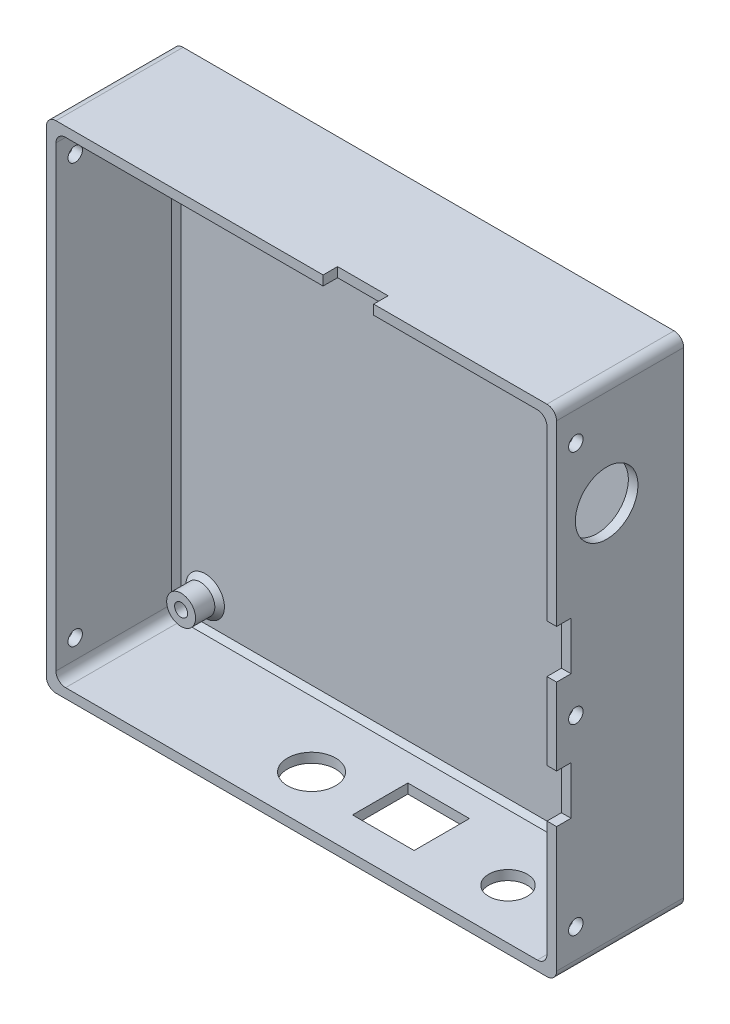
from build123d import *

# Parameters (mm, degrees)
SKETCH_1_W          = 106
SKETCH_1_H          = 103
SKETCH_1_W_2        = 102
SKETCH_1_H_2        = 99
EXTRUDE_1_DEPTH     = 25
SKETCH_2_W          = 106
SKETCH_2_H          = 103
EXTRUDE_2_DEPTH     = 1.4
SKETCH_3_R          = 3
SKETCH_3_R_2        = 1.35
EXTRUDE_3_DEPTH     = 5
SKETCH_4_W          = 12.8
SKETCH_4_H          = 11.5
CUT_EXTRUDE_1_DEPTH = 101
FILLET_1_R          = 2
CHAMFER_1_SIZE      = 1
SKETCH_5_R          = 4
SKETCH_5_R_2        = 5
CUT_EXTRUDE_2_DEPTH = 2
SKETCH_6_W          = 3
SKETCH_6_H          = 10
CUT_EXTRUDE_3_DEPTH = 2
SKETCH_8_R          = 1.5
CUT_EXTRUDE_4_DEPTH = 121.470950855
SKETCH_9_R          = 1.5
CUT_EXTRUDE_5_DEPTH = 2
SKETCH_10_W         = 10.5
SKETCH_10_H         = 3
CUT_EXTRUDE_6_DEPTH = 2
SKETCH_11_R         = 6.5
CUT_EXTRUDE_7_DEPTH = 2


with BuildPart() as part:
    # Эскиз1 → Бобышка-Вытянуть1 (new body)
    with BuildSketch(Plane.XY):
        Rectangle(SKETCH_1_W, SKETCH_1_H)
        Rectangle(SKETCH_1_W_2, SKETCH_1_H_2, mode=Mode.SUBTRACT)
    extrude(amount=EXTRUDE_1_DEPTH)

    # Эскиз2 → Бобышка-Вытянуть2 (add)
    with BuildSketch(Plane(origin=(0, 0, 0), x_dir=(-1, 0, 0), z_dir=(0, 0, -1))):
        Rectangle(SKETCH_2_W, SKETCH_2_H)
    extrude(amount=EXTRUDE_2_DEPTH)

    # Эскиз3 → Бобышка-Вытянуть3 (add)
    # profile 1 of 4: a face of its own
    with BuildSketch(Plane.XY):
        with Locations(Location((-45, 39.5, 0), (0, 0, 180))):
            Circle(SKETCH_3_R)
        with Locations((-45, 39.5)):
            Circle(SKETCH_3_R_2, mode=Mode.SUBTRACT)
    # profile 2 of 4: a face of its own
    with BuildSketch(Plane.XY):
        with Locations(Location((45, 39.5, 0), (0, 0, 180))):
            Circle(SKETCH_3_R)
        with Locations((45, 39.5)):
            Circle(SKETCH_3_R_2, mode=Mode.SUBTRACT)
    # profile 3 of 4: a face of its own
    with BuildSketch(Plane.XY):
        with Locations(Location((-45, -43.5, 0), (0, 0, 180))):
            Circle(SKETCH_3_R)
        with Locations((-45, -43.5)):
            Circle(SKETCH_3_R_2, mode=Mode.SUBTRACT)
    # profile 4 of 4: a face of its own
    with BuildSketch(Plane.XY):
        with Locations(Location((45, -43.5, 0), (0, 0, 180))):
            Circle(SKETCH_3_R)
        with Locations((45, -43.5)):
            Circle(SKETCH_3_R_2, mode=Mode.SUBTRACT)
    extrude(amount=EXTRUDE_3_DEPTH)

    # Эскиз4 → Вырез-Вытянуть1 (cut)
    with BuildSketch(Plane.XZ.offset(51.5)):
        with Locations((10.1, 12.35)):
            Rectangle(SKETCH_4_W, SKETCH_4_H)
    extrude(amount=-CUT_EXTRUDE_1_DEPTH, mode=Mode.SUBTRACT)

    # Скругление1
    fillet_1_edges = [part.edges().sort_by_distance(p)[0] for p in [
        (51, -49.5, 12.5),
        (51, 49.5, 12.5),
        (-51, 49.5, 12.5),
        (-51, -49.5, 12.5),
        (53, -51.5, 11.8),
        (-53, -51.5, 11.8),
        (-53, 51.5, 11.8),
        (53, 51.5, 11.8),
    ]]
    fillet(fillet_1_edges, radius=FILLET_1_R)

    # Фаска1
    chamfer_1_edges = [part.edges().sort_by_distance(p)[0] for p in [
        (-51, 0, 0),
        (0, -49.5, 0),
        (51, 0, 0),
        (0, 49.5, 0),
        (50.414213562, -48.914213562, 0),
        (50.414213562, 48.914213562, 0),
        (-50.414213562, 48.914213562, 0),
        (-50.414213562, -48.914213562, 0),
        (-42, 39.5, 0),
        (48, 39.5, 0),
        (-42, -43.5, 0),
        (48, -43.5, 0),
    ]]
    chamfer(chamfer_1_edges, length=CHAMFER_1_SIZE)

    # Эскиз5 → Вырез-Вытянуть2 (cut)
    with BuildSketch(Plane.XZ.offset(51.5)):
        with Locations(Location((32.5, 14.6, 0), (0, 0, 270))):
            Circle(SKETCH_5_R)
        with Locations(Location((-8.3, 14.6, 0), (0, 0, 270))):
            Circle(SKETCH_5_R_2)
    extrude(amount=-CUT_EXTRUDE_2_DEPTH, mode=Mode.SUBTRACT)

    # Эскиз6 → Вырез-Вытянуть3 (cut)
    with BuildSketch(Plane(origin=(53, 0, 0), x_dir=(0, 0, -1), z_dir=(1, 0, 0))):
        with Locations((-23.5, -18.5)):
            Rectangle(SKETCH_6_W, SKETCH_6_H)
        with Locations((-23.5, 7.5)):
            Rectangle(SKETCH_6_W, SKETCH_6_H)
    extrude(amount=-CUT_EXTRUDE_3_DEPTH, mode=Mode.SUBTRACT)

    # Эскиз8 → Вырез-Вытянуть4 (cut, through all)
    with BuildSketch(Plane(origin=(53, 0, 0), x_dir=(0, 0, -1), z_dir=(1, 0, 0))):
        with Locations((-21, 43.5)):
            Circle(SKETCH_8_R)
        with Locations((-21, -43.5)):
            Circle(SKETCH_8_R)
    extrude(amount=-CUT_EXTRUDE_4_DEPTH, mode=Mode.SUBTRACT)

    # Эскиз9 → Вырез-Вытянуть5 (cut)
    with BuildSketch(Plane(origin=(53, 0, 0), x_dir=(0, 0, -1), z_dir=(1, 0, 0))):
        with Locations((-21, -5.5)):
            Circle(SKETCH_9_R)
    extrude(amount=-CUT_EXTRUDE_5_DEPTH, mode=Mode.SUBTRACT)

    # Эскиз10 → Вырез-Вытянуть6 (cut)
    with BuildSketch(Plane(origin=(0, 51.5, 0), x_dir=(1, 0, 0), z_dir=(0, 1, 0))):
        with Locations((9.75, -23.5)):
            Rectangle(SKETCH_10_W, SKETCH_10_H)
    extrude(amount=-CUT_EXTRUDE_6_DEPTH, mode=Mode.SUBTRACT)

    # Эскиз11 → Вырез-Вытянуть7 (cut)
    with BuildSketch(Plane(origin=(53, -1.5, 0), x_dir=(0, 1, 0), z_dir=(-1, 0, 0))):
        with Locations(Location((31, -14.6, 0), (0, 0, 270))):
            Circle(SKETCH_11_R)
    extrude(amount=CUT_EXTRUDE_7_DEPTH, mode=Mode.SUBTRACT)


solid = part.part
